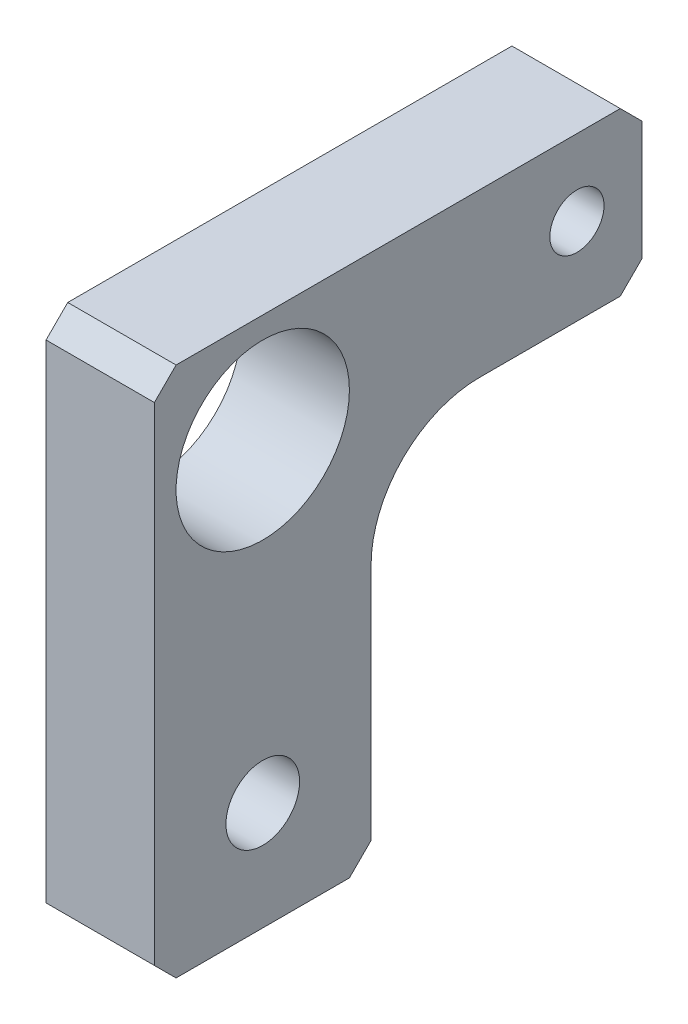
from build123d import *

# Parameters (mm, degrees)
SKETCH1_W              = 45
SKETCH1_H              = 49
BOSS_EXTRUDE1_DEPTH    = 5
SKETCH2_W              = 25
SKETCH2_H              = 34
CUT_EXTRUDE1_DEPTH     = 68.275552766
SKETCH3_R              = 8
CUT_EXTRUDE2_DEPTH     = 68.275552766
M8X1_25_TAPPED_HOLE1_D = 6.8
M6X1_0_TAPPED_HOLE1_D  = 5
FILLET1_R              = 10
CHAMFER1_SIZE          = 2


with BuildPart() as part:
    # Sketch1 → Boss-Extrude1 (new, symmetric)
    with BuildSketch(Plane(origin=(0, 0, 0), x_dir=(0, 0, -1), z_dir=(1, 0, 0))):
        with Locations((22.5, -24.5)):
            Rectangle(SKETCH1_W, SKETCH1_H)
    extrude(amount=BOSS_EXTRUDE1_DEPTH, both=True)

    # Sketch2 → Cut-Extrude1 (cut, through all)
    with BuildSketch(Plane(origin=(5, 0, 0), x_dir=(0, 0, -1), z_dir=(1, 0, 0))):
        with Locations((32.5, -32)):
            Rectangle(SKETCH2_W, SKETCH2_H)
    extrude(amount=-CUT_EXTRUDE1_DEPTH, mode=Mode.SUBTRACT)

    # Sketch3 → Cut-Extrude2 (cut, through all)
    with BuildSketch(Plane(origin=(5, 0, 0), x_dir=(0, 0, -1), z_dir=(1, 0, 0))):
        with Locations((10, -10)):
            Circle(SKETCH3_R)
    extrude(amount=-CUT_EXTRUDE2_DEPTH, mode=Mode.SUBTRACT)

    # M8x1.25 Tapped Hole1 (through all)
    with Locations(Plane(origin=(5, 0, 0), x_dir=(0, 0, -1), z_dir=(1, 0, 0))):
        with Locations((10, -39)):
            Hole(M8X1_25_TAPPED_HOLE1_D / 2)

    # M6x1.0 Tapped Hole1 (through all)
    with Locations(Plane(origin=(5, 0, 0), x_dir=(0, 0, -1), z_dir=(1, 0, 0))):
        with Locations((39, -7)):
            Hole(M6X1_0_TAPPED_HOLE1_D / 2)

    # Fillet1
    fillet1_edges = [part.edges().sort_by_distance(p)[0] for p in [
        (0, -15, -20),
    ]]
    fillet(fillet1_edges, radius=FILLET1_R)

    # Chamfer1
    chamfer1_edges = [part.edges().sort_by_distance(p)[0] for p in [
        (0, -15, -45),
        (0, -49, -20),
        (0, 0, 0),
        (0, 0, -45),
        (0, -49, 0),
    ]]
    chamfer(chamfer1_edges, length=CHAMFER1_SIZE)


solid = part.part
